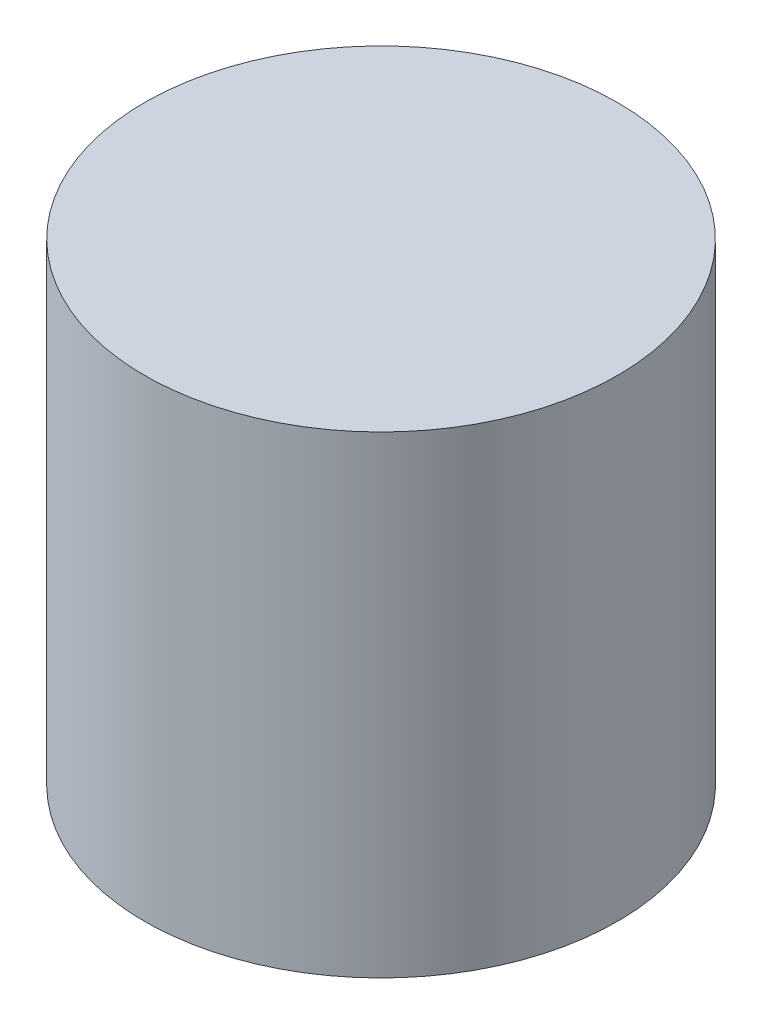
from build123d import *

# Parameters (mm, degrees)
SKETCH1_R           = 38.1
BOSS_EXTRUDE1_DEPTH = 76.2


with BuildPart() as part:
    # Sketch1 → Boss-Extrude1 (new body)
    with BuildSketch(Plane(origin=(0, 0, 0), x_dir=(1, 0, 0), z_dir=(0, 1, 0))):
        with Locations(Location((0, 0, 0), (0, 0, 90))):
            Circle(SKETCH1_R)
    extrude(amount=BOSS_EXTRUDE1_DEPTH)


solid = part.part
